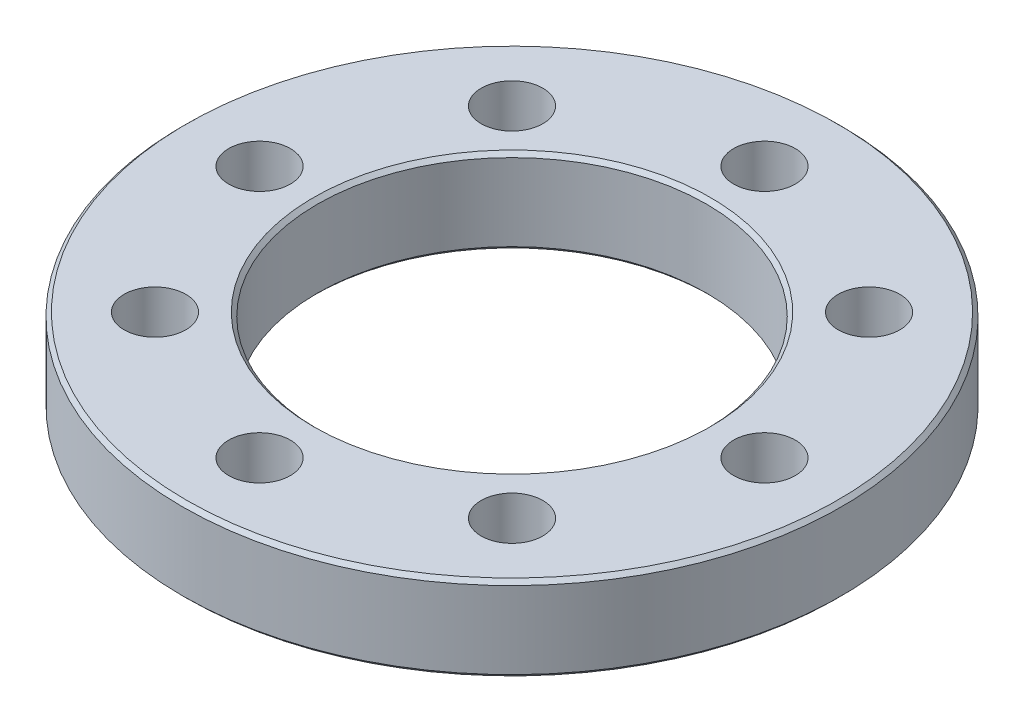
from build123d import *

# Parameters (mm, degrees)
SKETCH_1_R      = 85.5
SKETCH_1_R_2    = 50.5
EXTRUDE_1_DEPTH = 22
CHAMFER_1_SIZE  = 1
HOLE_WIZARD_1_D = 16


with BuildPart() as part:
    # 草图1 → 凸台-拉伸1 (new body)
    with BuildSketch(Plane(origin=(0, 0, 0), x_dir=(1, 0, 0), z_dir=(0, 1, 0))):
        with Locations(Location((0, 0, 0), (0, 0, 270))):
            Circle(SKETCH_1_R)
        with Locations(Location((0, 0, 0), (0, 0, 270))):
            Circle(SKETCH_1_R_2, mode=Mode.SUBTRACT)
    extrude(amount=EXTRUDE_1_DEPTH)

    # 倒角1
    chamfer_1_edges = [part.edges().sort_by_distance(p)[0] for p in [
        (0, 0, -85.5),
        (0, 22, -85.5),
        (0, 0, -50.5),
        (0, 22, -50.5),
    ]]
    chamfer(chamfer_1_edges, length=CHAMFER_1_SIZE)

    # 孔1 (through all)
    with Locations(Plane(origin=(0, 22, 0), x_dir=(1, 0, 0), z_dir=(0, 1, 0))):
        with Locations((46.315494168, 46.315494168), (65.5, 0), (46.315494168, -46.315494168), (0, -65.5), (-46.315494168, -46.315494168), (-65.5, 0), (-46.315494168, 46.315494168), (0, 65.5)):
            Hole(HOLE_WIZARD_1_D / 2)


solid = part.part
